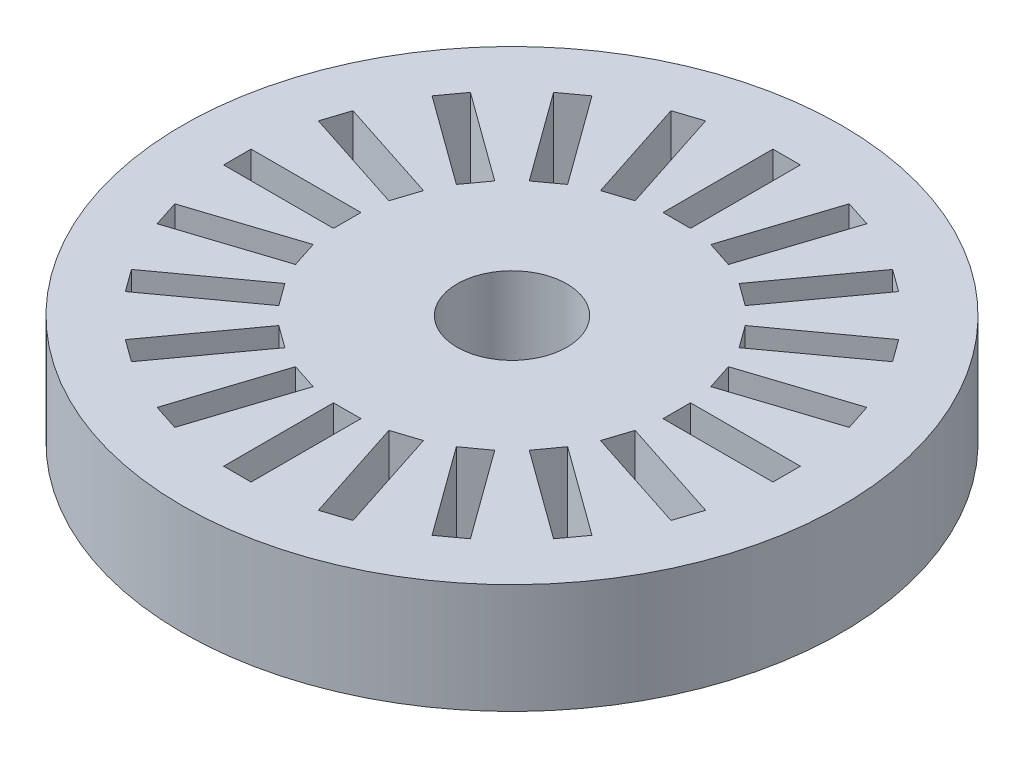
from build123d import *

# Parameters (mm, degrees)
SKETCH1_R           = 12
SKETCH1_R_2         = 2
BOSS_EXTRUDE1_DEPTH = 4


with BuildPart() as part:
    # Sketch1 → Boss-Extrude1 (new body)
    with BuildSketch(Plane(origin=(0, 0, 0), x_dir=(1, 0, 0), z_dir=(0, 1, 0))):
        with Locations(Location((0, 0, 0), (0, 0, 270))):
            Circle(SKETCH1_R)
        Polygon((-5.473344026, -8.38406257), (-5.877852523, -8.090169944), (-6.28236102, -7.796277318), (-3.931220011, -4.56020934), (-3.122203017, -5.147994592), align=None, mode=Mode.SUBTRACT)
        Polygon((-2.614641686, -9.66507366), (-3.090169944, -9.510565163), (-3.565698202, -9.356056666), (-2.329630224, -5.551830601), (-1.378573708, -5.860847595), align=None, mode=Mode.SUBTRACT)
        Polygon((-7.796277318, -6.28236102), (-8.090169944, -5.877852523), (-8.38406257, -5.473344026), (-5.147994592, -3.122203017), (-4.56020934, -3.931220011), align=None, mode=Mode.SUBTRACT)
        Polygon((-9.356056666, -3.565698202), (-9.510565163, -3.090169944), (-9.66507366, -2.614641686), (-5.860847595, -1.378573708), (-5.551830601, -2.329630224), align=None, mode=Mode.SUBTRACT)
        Polygon((0.5, -10), (0, -10), (-0.5, -10), (-0.5, -6), (0.5, -6), align=None, mode=Mode.SUBTRACT)
        Polygon((3.565698202, -9.356056666), (3.090169944, -9.510565163), (2.614641686, -9.66507366), (1.378573708, -5.860847595), (2.329630224, -5.551830601), align=None, mode=Mode.SUBTRACT)
        Polygon((6.28236102, -7.796277318), (5.877852523, -8.090169944), (5.473344026, -8.38406257), (3.122203017, -5.147994592), (3.931220011, -4.56020934), align=None, mode=Mode.SUBTRACT)
        Polygon((8.38406257, -5.473344026), (8.090169944, -5.877852523), (7.796277318, -6.28236102), (4.56020934, -3.931220011), (5.147994592, -3.122203017), align=None, mode=Mode.SUBTRACT)
        Polygon((9.66507366, -2.614641686), (9.510565163, -3.090169944), (9.356056666, -3.565698202), (5.551830601, -2.329630224), (5.860847595, -1.378573708), align=None, mode=Mode.SUBTRACT)
        Polygon((10, 0.5), (10, 0), (10, -0.5), (6, -0.5), (6, 0.5), align=None, mode=Mode.SUBTRACT)
        Polygon((-10, -0.5), (-10, 0), (-10, 0.5), (-6, 0.5), (-6, -0.5), align=None, mode=Mode.SUBTRACT)
        Polygon((-9.66507366, 2.614641686), (-9.510565163, 3.090169944), (-9.356056666, 3.565698202), (-5.551830601, 2.329630224), (-5.860847595, 1.378573708), align=None, mode=Mode.SUBTRACT)
        Polygon((-8.38406257, 5.473344026), (-8.090169944, 5.877852523), (-7.796277318, 6.28236102), (-4.56020934, 3.931220011), (-5.147994592, 3.122203017), align=None, mode=Mode.SUBTRACT)
        Polygon((-6.28236102, 7.796277318), (-5.877852523, 8.090169944), (-5.473344026, 8.38406257), (-3.122203017, 5.147994592), (-3.931220011, 4.56020934), align=None, mode=Mode.SUBTRACT)
        Polygon((-3.565698202, 9.356056666), (-3.090169944, 9.510565163), (-2.614641686, 9.66507366), (-1.378573708, 5.860847595), (-2.329630224, 5.551830601), align=None, mode=Mode.SUBTRACT)
        with Locations(Location((0, 0, 0), (0, 0, 270))):
            Circle(SKETCH1_R_2, mode=Mode.SUBTRACT)
        Polygon((9.356056666, 3.565698202), (9.510565163, 3.090169944), (9.66507366, 2.614641686), (5.860847595, 1.378573708), (5.551830601, 2.329630224), align=None, mode=Mode.SUBTRACT)
        Polygon((7.796277318, 6.28236102), (8.090169944, 5.877852523), (8.38406257, 5.473344026), (5.147994592, 3.122203017), (4.56020934, 3.931220011), align=None, mode=Mode.SUBTRACT)
        Polygon((-0.5, 10), (0, 10), (0.5, 10), (0.5, 6), (-0.5, 6), align=None, mode=Mode.SUBTRACT)
        Polygon((2.614641686, 9.66507366), (3.090169944, 9.510565163), (3.565698202, 9.356056666), (2.329630224, 5.551830601), (1.378573708, 5.860847595), align=None, mode=Mode.SUBTRACT)
        Polygon((5.473344026, 8.38406257), (5.877852523, 8.090169944), (6.28236102, 7.796277318), (3.931220011, 4.56020934), (3.122203017, 5.147994592), align=None, mode=Mode.SUBTRACT)
    extrude(amount=BOSS_EXTRUDE1_DEPTH)


solid = part.part
